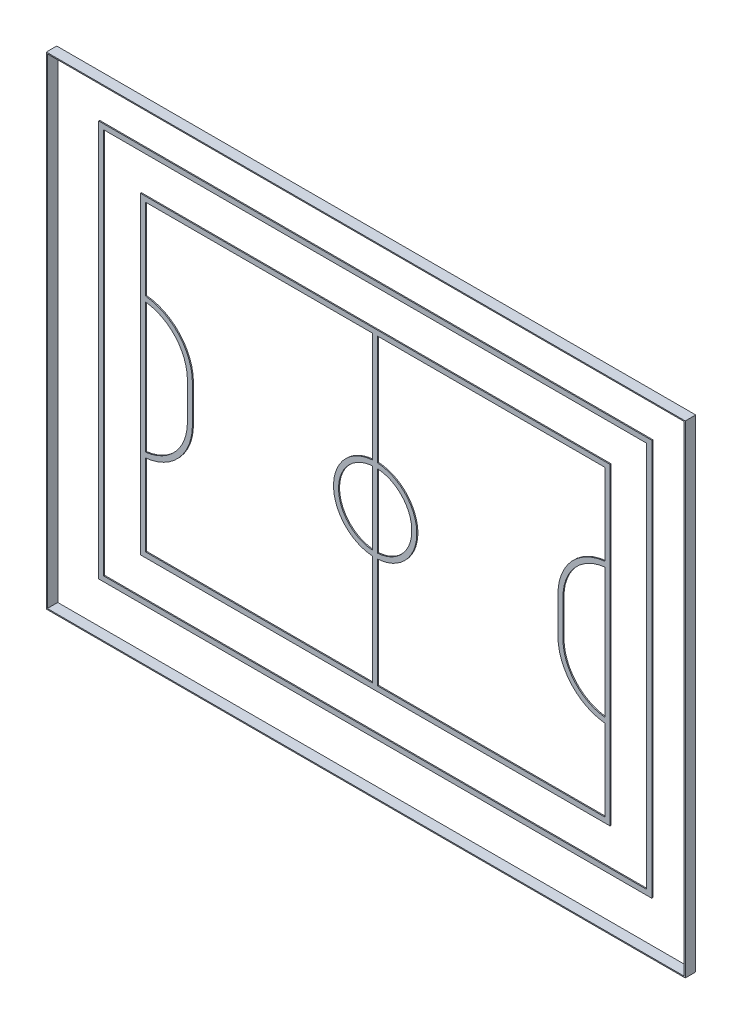
from build123d import *

# Parameters (mm, degrees)
SKETCH1_W             = 4500
SKETCH1_H             = 3000
BOSS_EXTRUDE1_DEPTH   = 10
SKETCH1_W_2           = 5300
SKETCH1_H_2           = 3800
SKETCH1_W_3           = 5202
SKETCH1_H_3           = 3702
BOSS_EXTRUDE1_2_DEPTH = 10
SKETCH1_3_W           = 6122
SKETCH1_3_H           = 4622
SKETCH1_3_W_2         = 6102
SKETCH1_3_H_2         = 4602
BOSS_EXTRUDE2_DEPTH   = 100


with BuildPart() as part:
    # Sketch1 → Boss-Extrude1 (new body)
    with BuildSketch(Plane.XY):
        Rectangle(SKETCH1_W, SKETCH1_H)
        with BuildLine():
            ThreePointArc((1799, -175), (1914.217332192, -476.083045022), (2201, -623.330235429))
            Line((2201, -623.330235429), (2201, 623.330235429))
            ThreePointArc((2201, 623.330235429), (1914.217332192, 476.083045022), (1799, 175))
            Line((1799, 175), (1799, -175))
        make_face(mode=Mode.SUBTRACT)
        with BuildLine():
            Line((-24, 398.277541421), (-24, 1451))
            Line((-24, 1451), (-2201, 1451))
            Line((-2201, 1451), (-2201, 671.588360717))
            ThreePointArc((-2201, 671.588360717), (-1880.235209897, 510.074618555), (-1751, 175))
            Line((-1751, 175), (-1751, -175))
            ThreePointArc((-1751, -175), (-1880.235209897, -510.074618555), (-2201, -671.588360717))
            Line((-2201, -671.588360717), (-2201, -1451))
            Line((-2201, -1451), (-24, -1451))
            Line((-24, -1451), (-24, -398.277541421))
            ThreePointArc((-24, -398.277541421), (-399, 0), (-24, 398.277541421))
        make_face(mode=Mode.SUBTRACT)
        with BuildLine():
            ThreePointArc((-2201, -623.330235429), (-1914.217332192, -476.083045022), (-1799, -175))
            Line((-1799, -175), (-1799, 175))
            ThreePointArc((-1799, 175), (-1914.217332192, 476.083045022), (-2201, 623.330235429))
            Line((-2201, 623.330235429), (-2201, -623.330235429))
        make_face(mode=Mode.SUBTRACT)
        with BuildLine():
            ThreePointArc((-24, 350.178525898), (-351, 0), (-24, -350.178525898))
            Line((-24, -350.178525898), (-24, 350.178525898))
        make_face(mode=Mode.SUBTRACT)
        with BuildLine():
            ThreePointArc((24, -350.178525898), (351, 0), (24, 350.178525898))
            Line((24, 350.178525898), (24, -350.178525898))
        make_face(mode=Mode.SUBTRACT)
        with BuildLine():
            Line((24, -1451), (24, -398.277541421))
            ThreePointArc((24, -398.277541421), (399, 0), (24, 398.277541421))
            Line((24, 398.277541421), (24, 1451))
            Line((24, 1451), (2201, 1451))
            Line((2201, 1451), (2201, 671.588360717))
            ThreePointArc((2201, 671.588360717), (1880.235209897, 510.074618555), (1751, 175))
            Line((1751, 175), (1751, -175))
            ThreePointArc((1751, -175), (1880.235209897, -510.074618555), (2201, -671.588360717))
            Line((2201, -671.588360717), (2201, -1451))
            Line((2201, -1451), (24, -1451))
        make_face(mode=Mode.SUBTRACT)
    extrude(amount=BOSS_EXTRUDE1_DEPTH)


with BuildPart() as body_2:
    # Sketch1 → Boss-Extrude1 2 (new body)
    with BuildSketch(Plane.XY):
        Rectangle(SKETCH1_W_2, SKETCH1_H_2)
        Rectangle(SKETCH1_W_3, SKETCH1_H_3, mode=Mode.SUBTRACT)
    extrude(amount=BOSS_EXTRUDE1_2_DEPTH)


with BuildPart() as body_3:
    # Sketch1<3> → Boss-Extrude2 (new body)
    with BuildSketch(Plane.XY):
        Rectangle(SKETCH1_3_W, SKETCH1_3_H)
        Rectangle(SKETCH1_3_W_2, SKETCH1_3_H_2, mode=Mode.SUBTRACT)
    extrude(amount=BOSS_EXTRUDE2_DEPTH)


solid = Compound([part.part, body_2.part, body_3.part])
